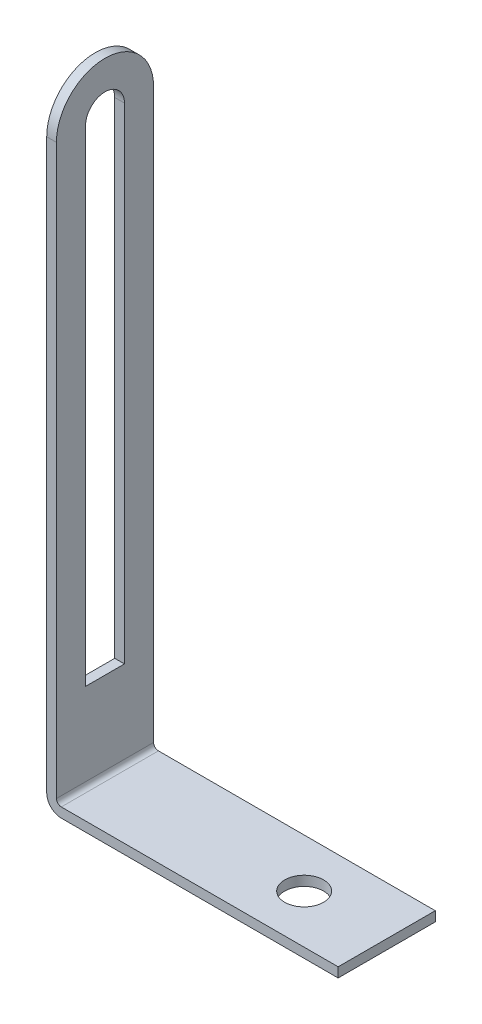
from build123d import *

# Parameters (mm, degrees)
AUFSATZ_LINEAR_AUSTRAGEN1_DEPTH = 1
AUFSATZ_LINEAR_AUSTRAGEN2_DEPTH = 10
SKIZZE3_R                       = 2
SCHNITT_LINEAR_AUSTRAGEN1_DEPTH = 72.763500472


with BuildPart() as part:
    # Skizze1 → Aufsatz-Linear austragen1 (new body)
    with BuildSketch(Plane(origin=(0, 0, 0), x_dir=(0, 0, -1), z_dir=(1, 0, 0))):
        with BuildLine():
            Line((-5, -25), (-5, -33.5))
            Line((-5, -33.5), (5, -33.5))
            Line((5, -33.5), (5, -25))
            Line((5, -25), (5, 25))
            ThreePointArc((5, 25), (0, 30), (-5, 25))
            Line((-5, 25), (-5, -25))
        make_face()
        with BuildLine():
            Line((-2, 25), (-2, -25))
            Line((-2, -25), (2, -25))
            Line((2, -25), (2, 25))
            ThreePointArc((2, 25), (0, 27), (-2, 25))
        make_face(mode=Mode.SUBTRACT)
    extrude(amount=AUFSATZ_LINEAR_AUSTRAGEN1_DEPTH)

    # Skizze2 → Aufsatz-Linear austragen2 (add)
    with BuildSketch(Plane.XY.offset(5)):
        with BuildLine():
            Line((1.5, -34), (30, -34))
            Line((30, -34), (30, -35))
            Line((30, -35), (1.5, -35))
            ThreePointArc((1.5, -35), (0.439339828, -34.560660172), (0, -33.5))
            Line((0, -33.5), (1, -33.5))
            ThreePointArc((1, -33.5), (1.146446609, -33.853553391), (1.5, -34))
        make_face()
    extrude(amount=-AUFSATZ_LINEAR_AUSTRAGEN2_DEPTH)

    # Skizze3 → Schnitt-Linear austragen1 (cut, through all)
    with BuildSketch(Plane.XZ.offset(35)):
        with Locations(Location((21.5, 0, 0), (0, 0, 270))):
            Circle(SKIZZE3_R)
    extrude(amount=-SCHNITT_LINEAR_AUSTRAGEN1_DEPTH, mode=Mode.SUBTRACT)


solid = part.part
